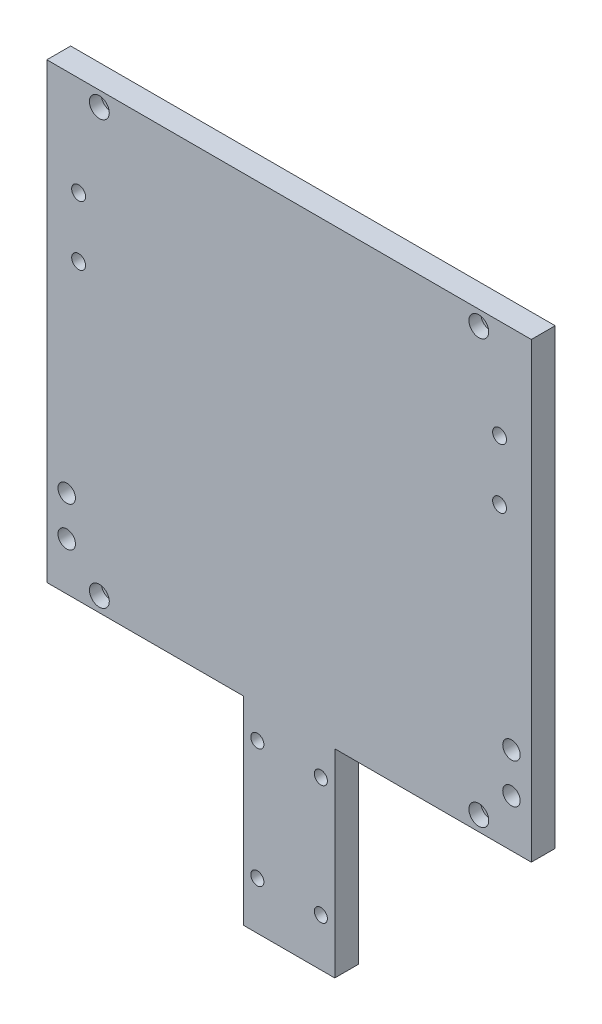
from build123d import *

# Parameters (mm, degrees)
SKETCH1_W           = 122
SKETCH1_H           = 114
BOSS_EXTRUDE1_DEPTH = 6
SKETCH2_R           = 1.65
CUT_EXTRUDE1_DEPTH  = 6
SKETCH3_R           = 2.5
CUT_EXTRUDE2_DEPTH  = 3
SKETCH4_R           = 1.75
SKETCH4_R_2         = 2.2
CUT_EXTRUDE3_DEPTH  = 84.701851831
SKETCH5_W           = 23
SKETCH5_H           = 50
BOSS_EXTRUDE2_DEPTH = 6
SKETCH6_R           = 1.65
CUT_EXTRUDE4_DEPTH  = 124.312610872


with BuildPart() as part:
    # Sketch1 → Boss-Extrude1 (new body)
    with BuildSketch(Plane.XY):
        Rectangle(SKETCH1_W, SKETCH1_H)
    extrude(amount=BOSS_EXTRUDE1_DEPTH)

    # Sketch2 → Cut-Extrude1 (cut)
    with BuildSketch(Plane.XY.offset(6)):
        with Locations((-47.78, 53.28)):
            Circle(SKETCH2_R)
        with Locations(Location((47.78, 53.28, 0), (0, 0, 180))):
            Circle(SKETCH2_R)
        with Locations((47.78, -53.28)):
            Circle(SKETCH2_R)
        with Locations(Location((-47.78, -53.28, 0), (0, 0, 180))):
            Circle(SKETCH2_R)
    extrude(amount=-CUT_EXTRUDE1_DEPTH, mode=Mode.SUBTRACT)

    # Sketch3 → Cut-Extrude2 (cut)
    with BuildSketch(Plane.XY.offset(6)):
        with Locations((-47.78, 53.28)):
            Circle(SKETCH3_R)
        with Locations(Location((47.78, 53.28, 0), (0, 0, 180))):
            Circle(SKETCH3_R)
        with Locations((47.78, -53.28)):
            Circle(SKETCH3_R)
        with Locations(Location((-47.78, -53.28, 0), (0, 0, 180))):
            Circle(SKETCH3_R)
    extrude(amount=-CUT_EXTRUDE2_DEPTH, mode=Mode.SUBTRACT)

    # Sketch4 → Cut-Extrude3 (cut, through all)
    with BuildSketch(Plane.XY.offset(6)):
        with Locations((-53, 32)):
            Circle(SKETCH4_R)
        with Locations((-53, 17)):
            Circle(SKETCH4_R)
        with Locations((-56, -35)):
            Circle(SKETCH4_R_2)
        with Locations((-56, -45)):
            Circle(SKETCH4_R_2)
    cut_extrude3 = extrude(amount=-CUT_EXTRUDE3_DEPTH, mode=Mode.SUBTRACT)

    # Mirror1: Cut-Extrude3 across plane
    add(cut_extrude3.mirror(Plane(origin=(0, 0, 0), x_dir=(0, 0, 1), z_dir=(1, 0, 0))), mode=Mode.SUBTRACT)

    # Sketch5 → Boss-Extrude2 (add, through all)
    with BuildSketch(Plane.XY.offset(6)):
        with Locations((0, -82)):
            Rectangle(SKETCH5_W, SKETCH5_H)
    extrude(amount=-BOSS_EXTRUDE2_DEPTH)

    # Sketch6 → Cut-Extrude4 (cut, through all)
    with BuildSketch(Plane.XY.offset(6)):
        with Locations((-8, -65)):
            Circle(SKETCH6_R)
        with Locations((-8, -95)):
            Circle(SKETCH6_R)
        with Locations(Location((8, -95, 0), (0, 0, 180))):
            Circle(SKETCH6_R)
        with Locations(Location((8, -65, 0), (0, 0, 180))):
            Circle(SKETCH6_R)
    extrude(amount=-CUT_EXTRUDE4_DEPTH, mode=Mode.SUBTRACT)


solid = part.part
